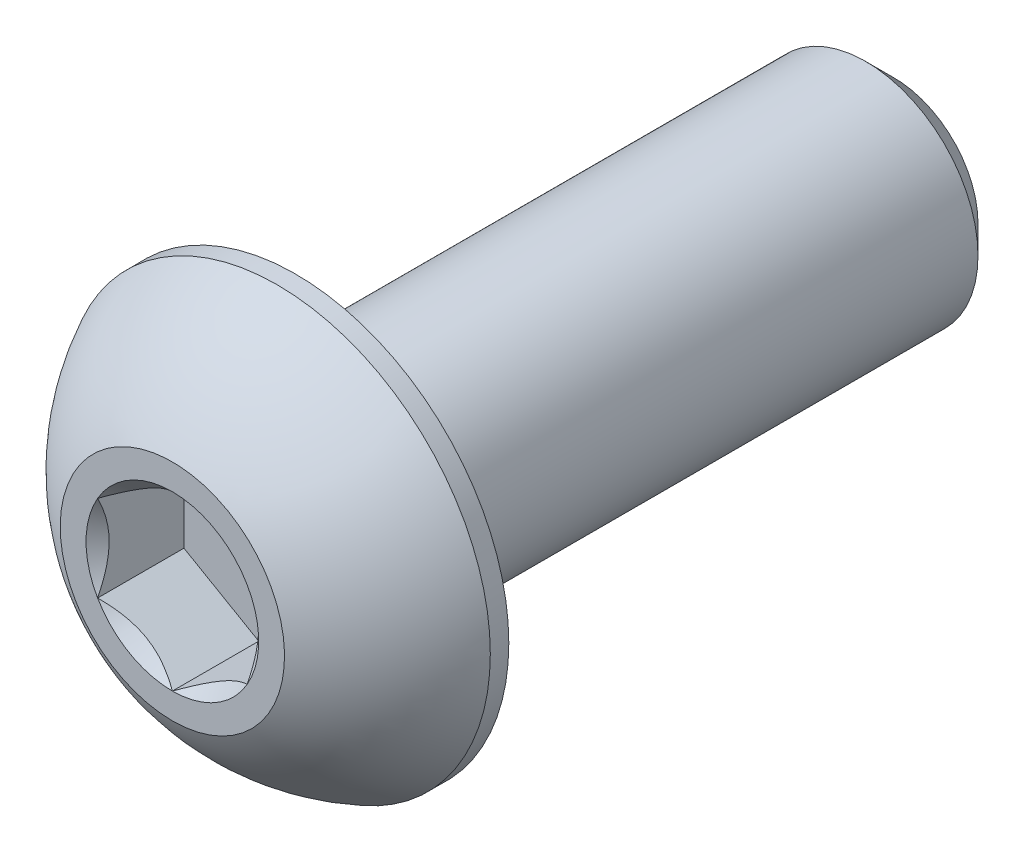
from build123d import *

# Parameters (mm, degrees)
CUT_EXTRUDE2_DEPTH = 1.155


with BuildPart() as part:
    # Sketch10 → Revolve3 (revolve)
    with BuildSketch(Plane(origin=(0, 0, 0), x_dir=(0, 0, -1), z_dir=(1, 0, 0))):
        Polygon((9.275, 1.5), (9.65, 1.125), (9.65, 0), (1.65, 0), (1.65, 1.5), align=None)
    revolve(axis=Axis((0, 0, 0), (0, 0, -1)))

    # Sketch7 → Revolve2 (revolve)
    with BuildSketch(Plane(origin=(0, 0, 0), x_dir=(0, 0, -1), z_dir=(1, 0, 0))):
        with BuildLine():
            Line((1.4025, 2.85), (1.65, 2.85))
            Line((1.65, 2.85), (1.65, 0))
            Line((1.65, 0), (0, 0))
            Line((0, 0), (0, 1.5))
            ThreePointArc((0, 1.5), (0.59512511, 2.285251969), (1.4025, 2.85))
        make_face()
    revolve(axis=Axis((0, 0, 0), (0, 0, -1)))

    # Sketch5 → Cut-Extrude2 (cut)
    with BuildSketch(Plane.XY):
        Polygon((1, -0.577350269), (1, 0.577350269), (0, 1.154700538), (-1, 0.577350269), (-1, -0.577350269), (0, -1.154700538), align=None)
    extrude(amount=-CUT_EXTRUDE2_DEPTH, mode=Mode.SUBTRACT)

    # Cut-Extrude3 cone 1 section (through the dimple's axis) → Cut-Extrude3 (revolve, cut)
    with BuildSketch(Plane(origin=(0, 0, 0), x_dir=(0, -1, 0), z_dir=(1, 0, 0))):
        Polygon((0, 0), (1.154700538, 0), (0, 1.154700538), align=None)
    revolve(axis=Axis((0, 0, 0), (0, 0, -1)), mode=Mode.SUBTRACT)


solid = part.part
